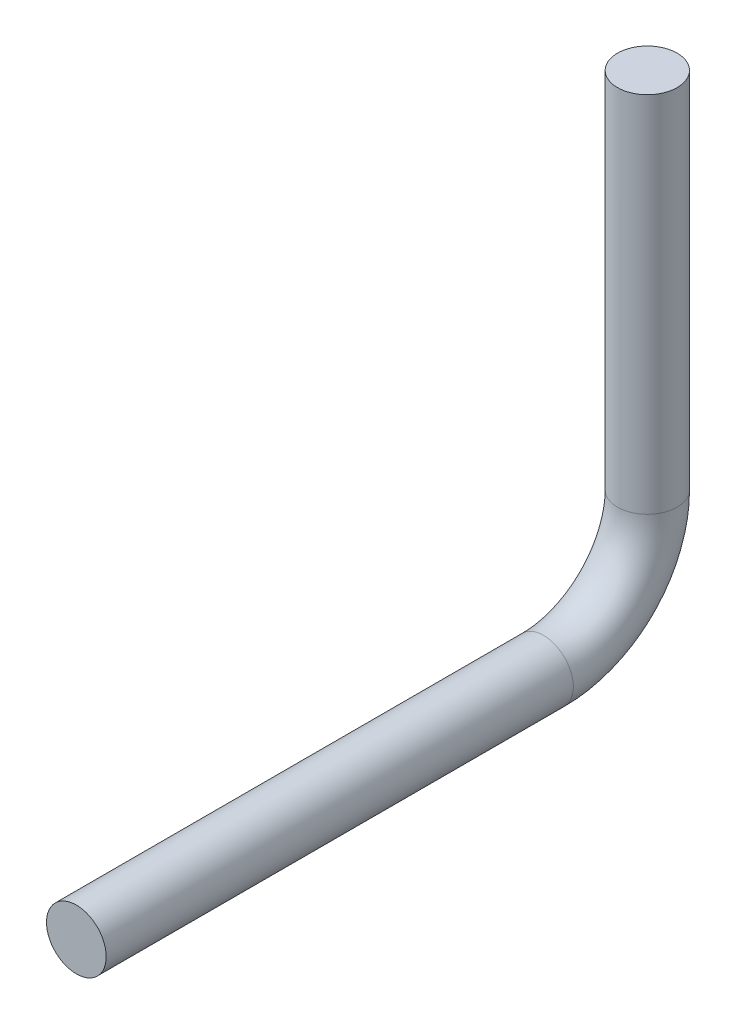
from build123d import *

# Parameters (mm, degrees)
SKETCH2_R = 7.3025


with BuildPart() as part:
    # Sweep1: sweep along a path in Sketch1
    with BuildLine(Plane(origin=(0, 0, 0), x_dir=(0, 0, -1), z_dir=(1, 0, 0))) as sweep1_path:
        Line((-139.7, 0), (-25.4, 0))
        ThreePointArc((-25.4, 0), (-7.439487758, 7.439487758), (0, 25.4))
        Line((0, 25.4), (0, 114.3))
    # Sketch2 → Sweep1 (sweep)
    with BuildSketch(Plane.XY.offset(139.7)):
        Circle(SKETCH2_R)
    sweep(path=sweep1_path.line)


solid = part.part
